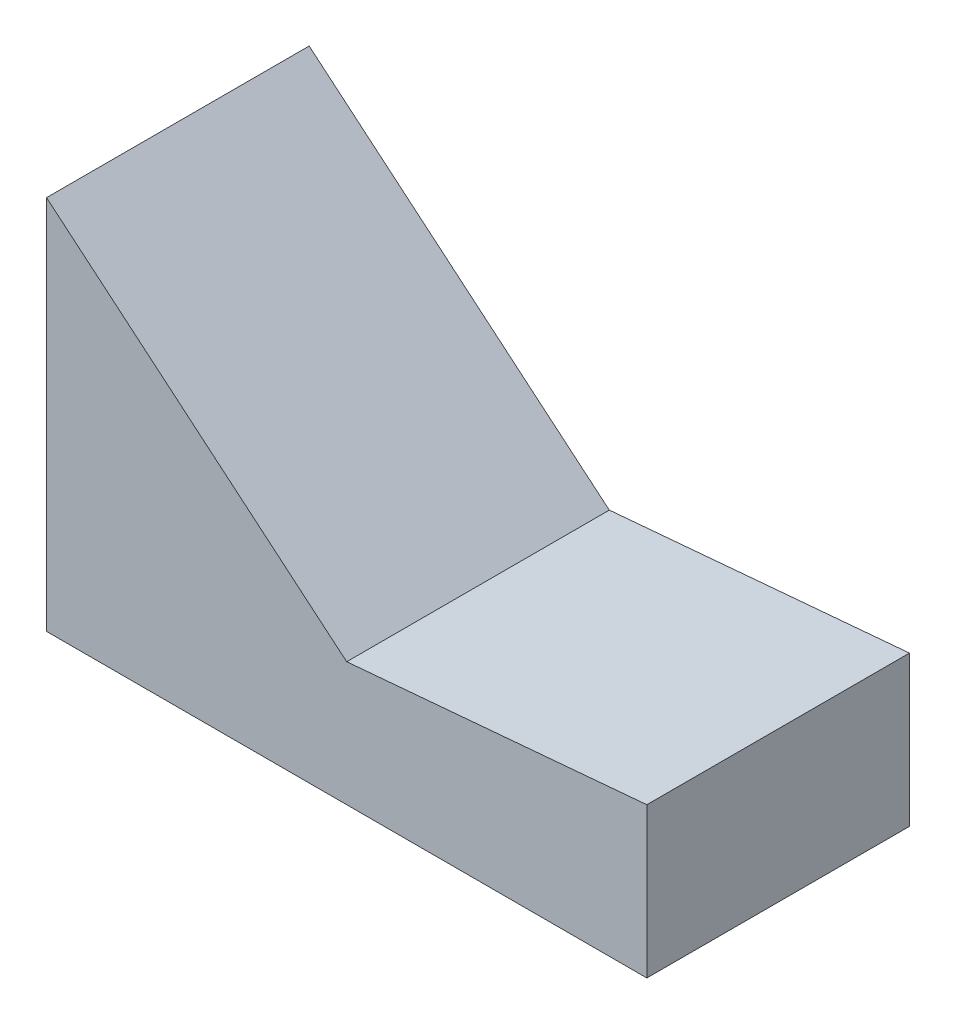
from build123d import *

# Parameters (mm, degrees)
BOSS_EXTRU_1_DEPTH = 17.5


with BuildPart() as part:
    # Esquisse1 → Boss.-Extru.1 (new, symmetric)
    with BuildSketch(Plane.XY):
        Polygon((-40, 0), (40, 0), (40, 20), (0, 16.500453459), (-40, 50.064438706), align=None)
    extrude(amount=BOSS_EXTRU_1_DEPTH, both=True)


solid = part.part
